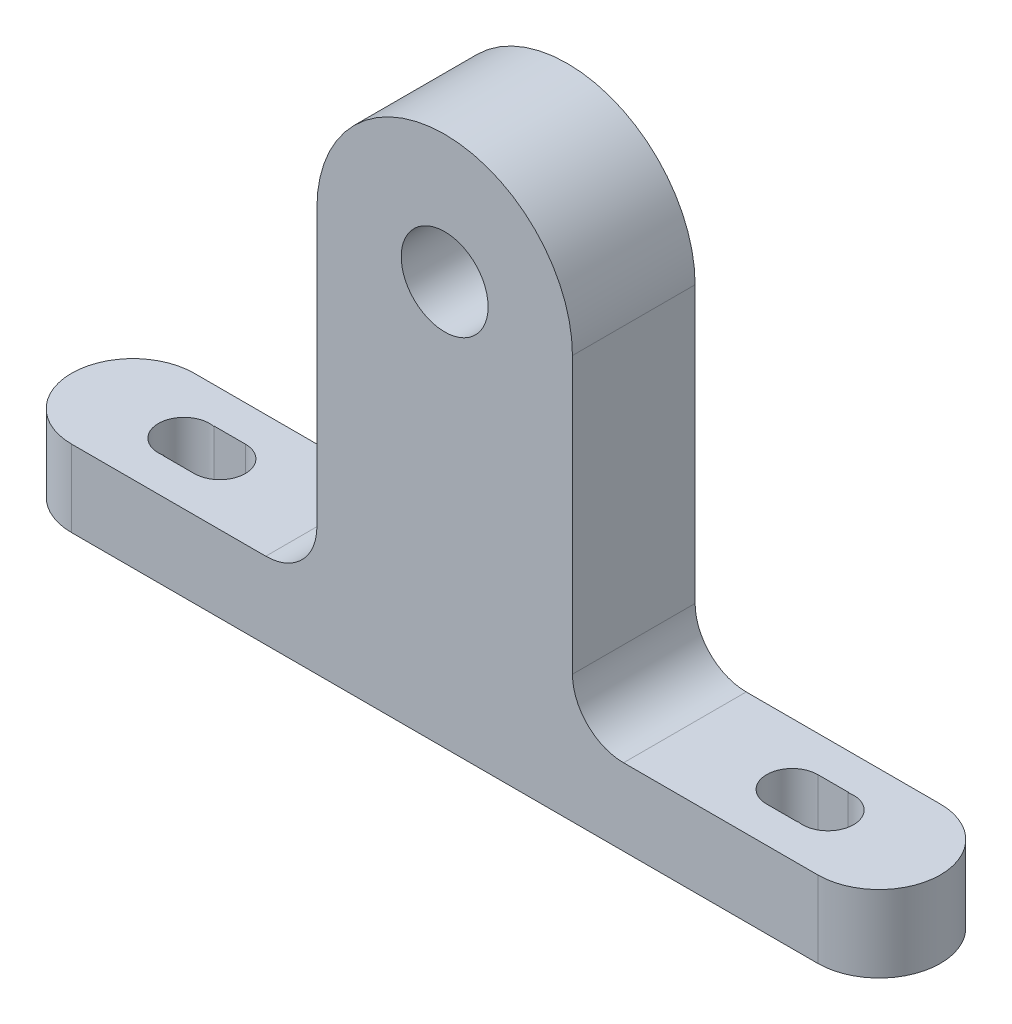
from build123d import *

# Parameters (mm, degrees)
BOSS_EXTRUDE1_DEPTH      = 6
BOSS_EXTRUDE1_DEPTH_BACK = 6
SKETCH1_R                = 4.25
CUT_EXTRUDE1_DEPTH       = 59.330952332
FILLET1_R                = 5


with BuildPart() as part:
    # Sketch1 → Boss-Extrude1 (new, two sides: drawn at the far end of the back side and taken through both)
    with BuildSketch(Plane.XY.offset(-BOSS_EXTRUDE1_DEPTH_BACK)):
        with BuildLine():
            Line((-42.5, -32), (-42.5, -39.5))
            Line((-42.5, -39.5), (42.5, -39.5))
            Line((42.5, -39.5), (42.5, -32))
            Line((42.5, -32), (12.5, -32))
            Line((12.5, -32), (12.5, 0))
            ThreePointArc((12.5, 0), (0, 12.5), (-12.5, 0))
            Line((-12.5, 0), (-12.5, -32))
            Line((-12.5, -32), (-42.5, -32))
        make_face()
        Circle(SKETCH1_R, mode=Mode.SUBTRACT)
    extrude(amount=BOSS_EXTRUDE1_DEPTH + BOSS_EXTRUDE1_DEPTH_BACK)

    # Sketch4 → Cut-Extrude1 (cut, through all)
    with BuildSketch(Plane(origin=(0, 0, 0), x_dir=(1, 0, 0), z_dir=(0, 1, 0))):
        with BuildLine():
            ThreePointArc((31.025, -2.454460226), (34, 0), (31.025, 2.454460226))
            ThreePointArc((31.025, 2.454460226), (31.035274533, 2.477251617), (31.045643943, 2.5))
            Line((31.045643943, 2.5), (28, 2.5))
            ThreePointArc((28, 2.5), (25.5, 0), (28, -2.5))
            Line((28, -2.5), (31.045643943, -2.5))
            ThreePointArc((31.045643943, -2.5), (31.035274533, -2.477251617), (31.025, -2.454460226))
        make_face()
        with BuildLine():
            ThreePointArc((42.5, 0), (40.742640687, -4.242640687), (36.5, -6))
            Line((36.5, -6), (42.5, -6))
            Line((42.5, -6), (42.5, 0))
        make_face()
        with BuildLine():
            Line((-42.5, -6), (-36.5, -6))
            ThreePointArc((-36.5, -6), (-40.742640687, -4.242640687), (-42.5, 0))
            Line((-42.5, 0), (-42.5, -6))
        make_face()
        with BuildLine():
            ThreePointArc((36.5, 6), (40.742640687, 4.242640687), (42.5, 0))
            Line((42.5, 0), (42.5, 6))
            Line((42.5, 6), (36.5, 6))
        make_face()
        with BuildLine():
            Line((-42.5, 6), (-42.5, 0))
            ThreePointArc((-42.5, 0), (-40.742640668, 4.242640706), (-36.499999946, 6))
            Line((-36.499999946, 6), (-42.5, 6))
        make_face()
        with BuildLine():
            ThreePointArc((-31.025, -2.454460226), (-31.035274533, -2.477251617), (-31.045643943, -2.5))
            Line((-31.045643943, -2.5), (-28, -2.5))
            ThreePointArc((-28, -2.5), (-25.5, 0), (-28, 2.5))
            Line((-28, 2.5), (-31.045643943, 2.5))
            ThreePointArc((-31.045643943, 2.5), (-31.035274533, 2.477251617), (-31.025, 2.454460226))
            ThreePointArc((-31.025, 2.454460226), (-34, 0), (-31.025, -2.454460226))
        make_face()
    extrude(amount=-CUT_EXTRUDE1_DEPTH, mode=Mode.SUBTRACT)

    # Fillet1
    fillet1_edges = [part.edges().sort_by_distance(p)[0] for p in [
        (-12.5, -32, 0),
        (12.5, -32, 0),
    ]]
    fillet(fillet1_edges, radius=FILLET1_R)


solid = part.part
